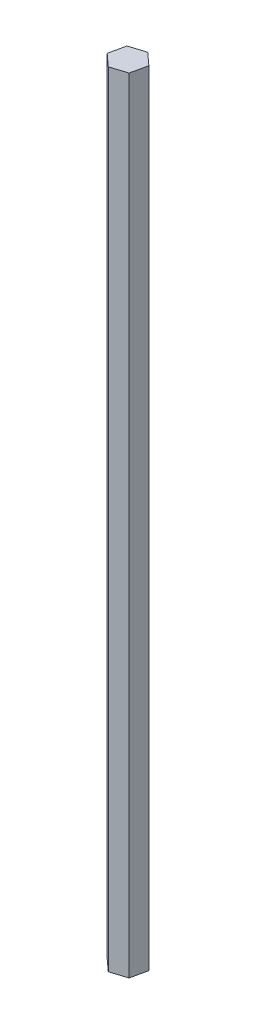
from build123d import *

# Parameters (mm, degrees)
BOSS_EXTRUDE1_DEPTH = 136.525


with BuildPart() as part:
    # Sketch2 → Boss-Extrude1 (new body)
    with BuildSketch(Plane(origin=(0, 0, 0), x_dir=(1, 0, 0), z_dir=(0, 1, 0))):
        Polygon((2.137295047, -1.940438924), (2.749116926, 0.880732344), (0.611821879, 2.821171268), (-2.137295047, 1.940438924), (-2.749116926, -0.880732344), (-0.611821879, -2.821171268), align=None)
    extrude(amount=BOSS_EXTRUDE1_DEPTH)


solid = part.part
